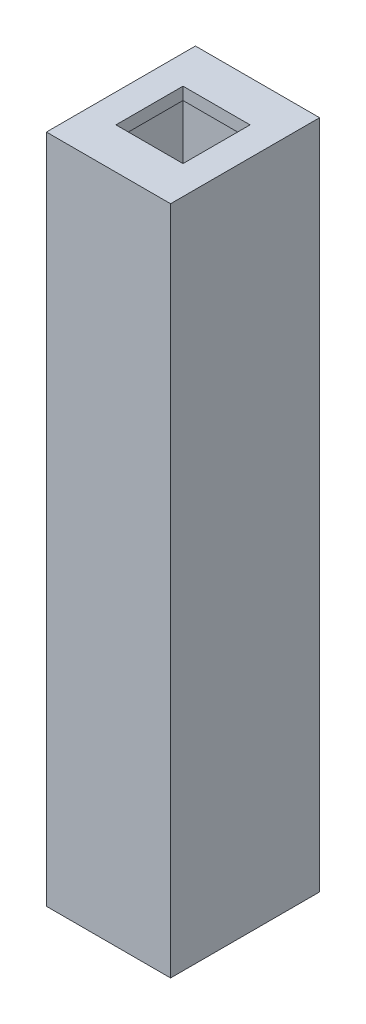
from build123d import *

# Parameters (mm, degrees)
SKETCH_1_W          = 10
SKETCH_1_H          = 12
SKETCH_1_W_2        = 6.2
SKETCH_1_H_2        = 6.2
EXTRUDE_1_DEPTH     = 54
EXTRUDE_START       = 54
SKETCH_1_3_W        = 10
SKETCH_1_3_H        = 12
SKETCH_1_3_W_2      = 6.2
SKETCH_1_3_H_2      = 6.2
SKETCH_1_3_W_3      = 5.4
SKETCH_1_3_H_3      = 5.4
EXTRUDE_2_DEPTH     = 1
SKETCH_2_R          = 0.3
CUT_EXTRUDE_1_DEPTH = 2


with BuildPart() as part:
    # 草图1 → 凸台-拉伸1 (new body)
    with BuildSketch(Plane(origin=(0, 0, 0), x_dir=(1, 0, 0), z_dir=(0, 1, 0))):
        Rectangle(SKETCH_1_W, SKETCH_1_H)
        Rectangle(SKETCH_1_W_2, SKETCH_1_H_2, mode=Mode.SUBTRACT)
    extrude(amount=EXTRUDE_1_DEPTH)

    # 草图1<3> → 凸台-拉伸2 (add)
    # profile 1 of 2: a face of its own
    with BuildSketch(Plane(origin=(0, 0, 0), x_dir=(1, 0, 0), z_dir=(0, 1, 0)).offset(EXTRUDE_START)):
        Rectangle(SKETCH_1_3_W, SKETCH_1_3_H)
        Rectangle(SKETCH_1_3_W_2, SKETCH_1_3_H_2, mode=Mode.SUBTRACT)
    # profile 2 of 2: a face of its own
    with BuildSketch(Plane(origin=(0, 0, 0), x_dir=(1, 0, 0), z_dir=(0, 1, 0)).offset(EXTRUDE_START)):
        Rectangle(SKETCH_1_3_W_2, SKETCH_1_3_H_2)
        Rectangle(SKETCH_1_3_W_3, SKETCH_1_3_H_3, mode=Mode.SUBTRACT)
    extrude(amount=-EXTRUDE_2_DEPTH)

    # 草图2 → 切除-拉伸1 (cut)
    with BuildSketch(Plane.XZ):
        with Locations(Location((-3.75, 4.5, 0), (0, 0, 270))):
            Circle(SKETCH_2_R)
        with Locations(Location((3.75, -4.5, 0), (0, 0, 270))):
            Circle(SKETCH_2_R)
        with Locations(Location((3.75, 4.5, 0), (0, 0, 270))):
            Circle(SKETCH_2_R)
        with Locations(Location((-3.75, -4.5, 0), (0, 0, 270))):
            Circle(SKETCH_2_R)
    extrude(amount=-CUT_EXTRUDE_1_DEPTH, mode=Mode.SUBTRACT)


solid = part.part
